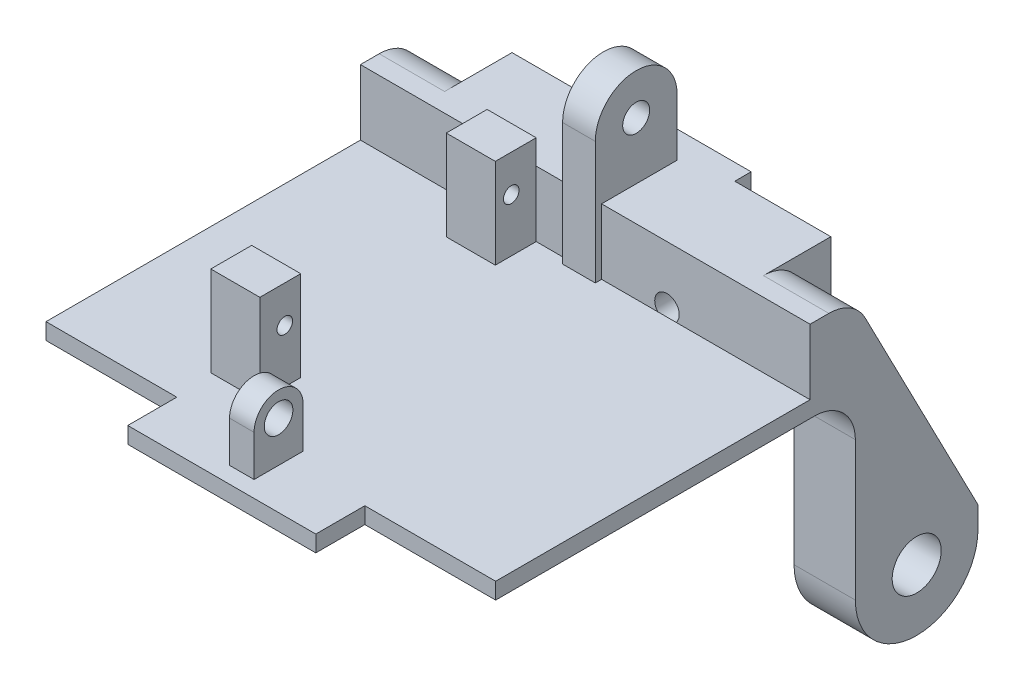
from build123d import *

# Parameters (mm, degrees)
SKETCH_1_W          = 55
SKETCH_1_H          = 39
EXTRUDE_1_DEPTH     = 2
SKETCH_2_W          = 23
SKETCH_2_H          = 6
EXTRUDE_2_DEPTH     = 2
SKETCH_3_W          = 6
SKETCH_3_H          = 5
EXTRUDE_3_DEPTH     = 11
SKETCH_5_R          = 0.95
CUT_EXTRUDE_1_DEPTH = 11
SKETCH_6_W          = 55
SKETCH_6_H          = 0.541458129
EXTRUDE_4_DEPTH     = 8
SKETCH_8_R          = 1.65
EXTRUDE_6_DEPTH     = 2
SKETCH_10_W         = 3
SKETCH_10_H         = 6
EXTRUDE_7_DEPTH     = 8
SKETCH_11_R         = 1.5
CUT_EXTRUDE_3_DEPTH = 13
SKETCH_12_R         = 3
EXTRUDE_8_DEPTH     = 7.5
SKETCH_13_W         = 10
SKETCH_13_H         = 3.7
EXTRUDE_9_DEPTH     = 1
FILLET_3_RADIUS     = 3
FILLET_3_LENGTH     = 3
SKETCH_15_R         = 1.75
CUT_EXTRUDE_5_DEPTH = 23
SKETCH_16_W         = 15.5
SKETCH_16_H         = 4
EXTRUDE_10_DEPTH    = 20
SKETCH_17_R         = 1.5
EXTRUDE_11_DEPTH    = 10
FILLET_4_R          = 10
SKETCH_18_W         = 26.564734734
SKETCH_18_H         = 10.454508508
CUT_EXTRUDE_6_DEPTH = 10
CUT_EXTRUDE_7_DEPTH = 8
CUT_EXTRUDE_8_DEPTH = 8
FILLET_6_R          = 5
SKETCH_21_R         = 1.4
CUT_EXTRUDE_9_DEPTH = 4


with BuildPart() as part:
    # 草图1 → 凸台-拉伸1 (new body)
    with BuildSketch(Plane(origin=(0, 0, 0), x_dir=(1, 0, 0), z_dir=(0, 1, 0))):
        Rectangle(SKETCH_1_W, SKETCH_1_H)
    extrude(amount=EXTRUDE_1_DEPTH)

    # 草图2 → 凸台-拉伸2 (add)
    with BuildSketch(Plane(origin=(0, 2, 0), x_dir=(1, 0, 0), z_dir=(0, 1, 0))):
        with Locations((0, -22.5)):
            Rectangle(SKETCH_2_W, SKETCH_2_H)
    extrude(amount=-EXTRUDE_2_DEPTH)

    # 草图3 → 凸台-拉伸3 (add)
    with BuildSketch(Plane(origin=(0, 2, 0), x_dir=(1, 0, 0), z_dir=(0, 1, 0))):
        with Locations((-9, -12.341458129)):
            Rectangle(SKETCH_3_W, SKETCH_3_H)
        with Locations((-9, 16.458541871)):
            Rectangle(SKETCH_3_W, SKETCH_3_H)
    extrude(amount=EXTRUDE_3_DEPTH)

    # 草图5 → 切除-拉伸1 (cut)
    with BuildSketch(Plane.ZY.offset(12)):
        with Locations((-15.908541871, 8.5)):
            Circle(SKETCH_5_R)
        with Locations((11.791458129, 8.5)):
            Circle(SKETCH_5_R)
    extrude(amount=-CUT_EXTRUDE_1_DEPTH, mode=Mode.SUBTRACT)

    # 草图6 → 凸台-拉伸4 (add)
    with BuildSketch(Plane(origin=(0, 2, 0), x_dir=(1, 0, 0), z_dir=(0, 1, 0))):
        with Locations((0, 19.229270936)):
            Rectangle(SKETCH_6_W, SKETCH_6_H)
    extrude(amount=EXTRUDE_4_DEPTH)

    # 草图8 → 凸台-拉伸6 (add, symmetric)
    with BuildSketch(Plane(origin=(0, 0, 0), x_dir=(0, 0, -1), z_dir=(1, 0, 0))):
        with BuildLine():
            Line((28.189872998, 17), (28.189872998, 0))
            Line((28.189872998, 0), (18.189872998, 0))
            Line((18.189872998, 0), (18.189872998, 17))
            ThreePointArc((18.189872998, 17), (23.189872998, 22), (28.189872998, 17))
        make_face()
        with Locations((23.189872998, 17)):
            Circle(SKETCH_8_R, mode=Mode.SUBTRACT)
    extrude(amount=EXTRUDE_6_DEPTH, both=True)

    # 草图10 → 凸台-拉伸7 (add)
    with BuildSketch(Plane(origin=(0, 2, 0), x_dir=(1, 0, 0), z_dir=(0, 1, 0))):
        with Locations((0.45, -20.5)):
            Rectangle(SKETCH_10_W, SKETCH_10_H)
    extrude(amount=EXTRUDE_7_DEPTH)

    # 草图11 → 切除-拉伸3 (cut)
    with BuildSketch(Plane.XY.offset(-18.958541871)):
        with Locations((-10, 3)):
            Circle(SKETCH_11_R)
    cut_extrude_3 = extrude(amount=-CUT_EXTRUDE_3_DEPTH, mode=Mode.SUBTRACT)

    # 草图12 → 凸台-拉伸8 (add)
    with BuildSketch(Plane.ZY.offset(27.5)):
        with BuildLine():
            Line((-39.5, -22), (-39.5, 10))
            Line((-39.5, 10), (-19.5, 10))
            Line((-19.5, 10), (-19.5, 0))
            Line((-19.5, 0), (-24.5, 0))
            Line((-24.5, 0), (-24.5, -22))
            ThreePointArc((-24.5, -22), (-32, -29.5), (-39.5, -22))
        make_face()
        with Locations((-32, -22)):
            Circle(SKETCH_12_R, mode=Mode.SUBTRACT)
    extrude_8 = extrude(amount=-EXTRUDE_8_DEPTH)

    # 草图13 → 凸台-拉伸9 (add)
    with BuildSketch(Plane.XZ):
        with Locations((0, 18.15)):
            Rectangle(SKETCH_13_W, SKETCH_13_H)
    extrude(amount=EXTRUDE_9_DEPTH)

    # 镜向1: 切除-拉伸3, 凸台-拉伸8 across plane
    add(cut_extrude_3.mirror(Plane(origin=(0, 0, 0), x_dir=(0, 0, 1), z_dir=(1, 0, 0))), mode=Mode.SUBTRACT)
    add(extrude_8.mirror(Plane(origin=(0, 0, 0), x_dir=(0, 0, 1), z_dir=(1, 0, 0))))

    # 圆角3: full round fillet: the end face becomes a half cylinder, R = half its width
    fillet_3_face = Plane((0.45, 10, 20.5), x_dir=(1, 0, 0), z_dir=(0, 1, 0))  # on the end face: x along it, z out of the body
    fillet_3_slab = fillet_3_face.offset(-FILLET_3_RADIUS / 2) * Box(FILLET_3_LENGTH, 2 * FILLET_3_RADIUS, FILLET_3_RADIUS, mode=Mode.PRIVATE)  # the body's end, R deep
    fillet_3_round = Plane((0.45, 7, 20.5), x_dir=(0, 1, 0), z_dir=(1, 0, 0)) * Cylinder(FILLET_3_RADIUS, FILLET_3_LENGTH, mode=Mode.PRIVATE)  # its axis R under the face
    add(fillet_3_slab - fillet_3_round, mode=Mode.SUBTRACT)

    # 草图15 → 切除-拉伸5 (cut)
    with BuildSketch(Plane.ZY.offset(1.05)):
        with Locations((20.5, 7)):
            Circle(SKETCH_15_R)
    extrude(amount=-CUT_EXTRUDE_5_DEPTH, mode=Mode.SUBTRACT)

    # 草图16 → 凸台-拉伸10 (add)
    with BuildSketch(Plane(origin=(0, 0, -19.5), x_dir=(-1, 0, 0), z_dir=(0, 0, -1))):
        with Locations((0, 8)):
            Rectangle(SKETCH_16_W, SKETCH_16_H)
    extrude(amount=EXTRUDE_10_DEPTH)

    # 草图17 → 凸台-拉伸11 (add)
    # profile 1 of 2: a face of its own
    with BuildSketch(Plane(origin=(0, 0, -19.5), x_dir=(-1, 0, 0), z_dir=(0, 0, -1))):
        Polygon((-20, 0), (-2, 0), (-2, 6), (-7.75, 6), (-7.75, 10), (-20, 10), align=None)
        with Locations(Location((-10, 3, 0), (0, 0, 221.810314896))):
            Circle(SKETCH_17_R, mode=Mode.SUBTRACT)
    # profile 2 of 2: a face of its own
    with BuildSketch(Plane(origin=(0, 0, -19.5), x_dir=(-1, 0, 0), z_dir=(0, 0, -1))):
        Polygon((7.75, 6), (2, 6), (2, 0), (20, 0), (20, 10), (7.75, 10), align=None)
        with Locations(Location((10, 3, 0), (0, 0, 180))):
            Circle(SKETCH_17_R, mode=Mode.SUBTRACT)
    extrude(amount=EXTRUDE_11_DEPTH)

    # 圆角4
    fillet_4_edges = [part.edges().sort_by_distance(p)[0] for p in [
        (23.75, 10, -39.5),
        (-23.75, 10, -39.5),
    ]]
    fillet(fillet_4_edges, radius=FILLET_4_R)

    # 草图18 → 切除-拉伸6 (cut)
    with BuildSketch(Plane(origin=(0, 10, 0), x_dir=(1, 0, 0), z_dir=(0, 1, 0))):
        with Locations((-0.840887807, 36.727254254)):
            Rectangle(SKETCH_18_W, SKETCH_18_H)
    extrude(amount=-CUT_EXTRUDE_6_DEPTH, mode=Mode.SUBTRACT)

    # 草图19 → 切除-拉伸7 (cut)
    with BuildSketch(Plane(origin=(27.5, 0, 0), x_dir=(0, 0, -1), z_dir=(1, 0, 0))):
        Polygon((24.3, 10), (39.5, -19.395601839), (39.5, 10), align=None)
    extrude(amount=-CUT_EXTRUDE_7_DEPTH, mode=Mode.SUBTRACT)

    # 草图20 → 切除-拉伸8 (cut)
    with BuildSketch(Plane.ZY.offset(27.5)):
        Polygon((-24.3, 10), (-39.5, 10), (-39.5, -19.395601839), align=None)
    extrude(amount=-CUT_EXTRUDE_8_DEPTH, mode=Mode.SUBTRACT)

    # 圆角6
    fillet_6_edges = [part.edges().sort_by_distance(p)[0] for p in [
        (-23.75, 0, -24.5),
        (23.75, 0, -24.5),
        (23.5, 10, -24.3),
        (-23.5, 10, -24.3),
    ]]
    fillet(fillet_6_edges, radius=FILLET_6_R)

    # 草图21 → 切除-拉伸9 (cut)
    with BuildSketch(Plane.XZ.offset(1)):
        with Locations(Location((0, 18.05, 0), (0, 0, 270))):
            Circle(SKETCH_21_R)
    extrude(amount=-CUT_EXTRUDE_9_DEPTH, mode=Mode.SUBTRACT)


solid = part.part
